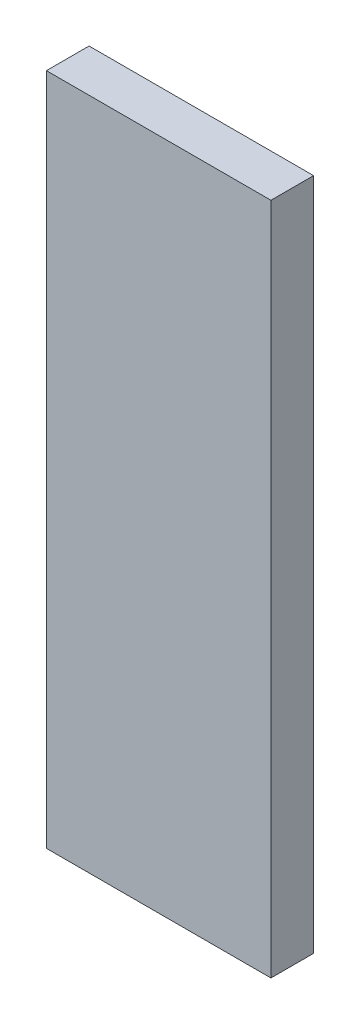
from build123d import *

# Parameters (mm, degrees)
SKETCH1_W           = 100
SKETCH1_H           = 300
BOSS_EXTRUDE1_DEPTH = 19


with BuildPart() as part:
    # Sketch1 → Boss-Extrude1 (new body)
    with BuildSketch(Plane.XY):
        with Locations((50, 150)):
            Rectangle(SKETCH1_W, SKETCH1_H)
    extrude(amount=BOSS_EXTRUDE1_DEPTH)


solid = part.part
